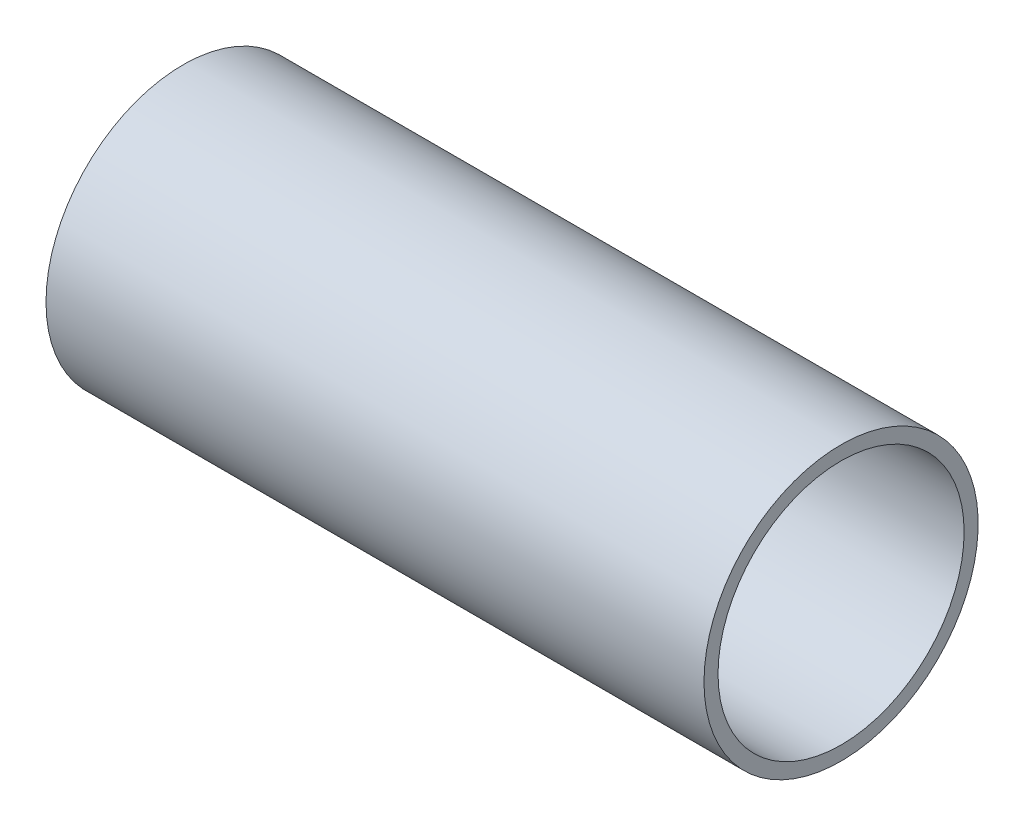
from build123d import *

# Parameters (mm, degrees)
SKETCH1_R          = 15.875
SKETCH1_R_2        = 14.25
BASE_EXTRUDE_DEPTH = 76.2


with BuildPart() as part:
    # Sketch1 → Base-Extrude (new body)
    with BuildSketch(Plane(origin=(0, 0, 0), x_dir=(0, 0, -1), z_dir=(1, 0, 0))):
        with Locations(Location((0, 0, 0), (0, 0, 180))):
            Circle(SKETCH1_R)
        with Locations(Location((0, 0, 0), (0, 0, 180))):
            Circle(SKETCH1_R_2, mode=Mode.SUBTRACT)
    extrude(amount=BASE_EXTRUDE_DEPTH)


solid = part.part
